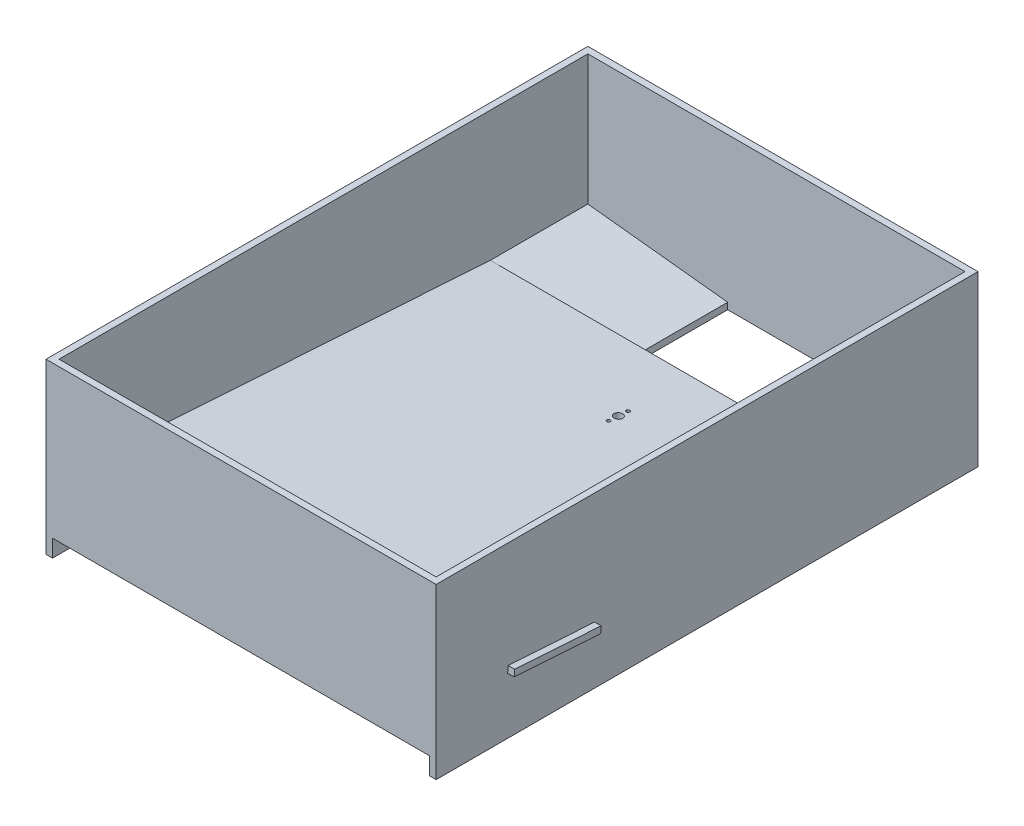
from build123d import *

# Parameters (mm, degrees)
SKETCH_1_W           = 180
SKETCH_1_H           = 250
EXTRUDE_1_DEPTH      = 70
SHELL_1_T            = -3
EXTRUDE_2_REACH      = 229.715
EXTRUDE_3_DEPTH      = 45
SKETCH_5_W           = 174
SKETCH_5_H           = 6.993605462
EXTRUDE_6_DEPTH      = 3
EXTRUDE_7_DEPTH      = 180
EXTRUDE_7_DEPTH_BACK = 6
SKETCH_12_W          = 3
SKETCH_12_H          = 250
EXTRUDE_8_DEPTH      = 8
SKETCH_13_R          = 2
SKETCH_13_R_2        = 0.8
CUT_EXTRUDE_1_DEPTH  = 3


with BuildPart() as part:
    # 草图1 → 凸台-拉伸1 (new body)
    with BuildSketch(Plane(origin=(0, 0, 0), x_dir=(1, 0, 0), z_dir=(0, 1, 0))):
        Rectangle(SKETCH_1_W, SKETCH_1_H)
    extrude(amount=EXTRUDE_1_DEPTH)

    # 抽壳1
    shell_1_openings = [part.faces().sort_by_distance(p)[0] for p in [
        (0, 70, 0),
        (0, 0, 0),
    ]]
    offset(amount=SHELL_1_T, openings=shell_1_openings, kind=Kind.INTERSECTION)

    # 草图3 → 凸台-拉伸2 (add, up to next)
    with BuildSketch(Plane(origin=(-87, 0, 0), x_dir=(0, 0, -1), z_dir=(1, 0, 0)), mode=Mode.PRIVATE) as extrude_2_sk1:
        Polygon((-122, 23), (77, 10), (77, 6.993605462), (-122, 19.993605462), align=None)
    extrude_2_tool1 = extrude(extrude_2_sk1.sketch, amount=EXTRUDE_2_REACH, mode=Mode.PRIVATE) - part.part
    add(extrude_2_tool1.solids().sort_by_distance((-87, 14.996803, 22.5))[0])

    # 草图4 → 凸台-拉伸3 (add)
    with BuildSketch(Plane.XY.offset(-122)):
        Polygon((-87, 10), (-87, 7), (-22.5, 0), (-22.5, 3), align=None)
        Polygon((22.5, 3), (87, 10), (87, 7), (22.5, 0), align=None)
    extrude(amount=EXTRUDE_3_DEPTH)

    # 草图6 → 凸台-拉伸7 (add, two sides: drawn at the far end of the back side and taken through both)
    with BuildSketch(Plane(origin=(-87, 0, 0), x_dir=(0, 0, -1), z_dir=(1, 0, 0)).offset(-EXTRUDE_7_DEPTH_BACK)):
        Polygon((-92, 18.033806467), (-52.085079166, 15.426299075), (-51.889516111, 18.419918138), (-91.804436946, 21.027425529), align=None)
    extrude(amount=EXTRUDE_7_DEPTH + EXTRUDE_7_DEPTH_BACK)

    # 草图12 → 凸台-拉伸8 (add)
    with BuildSketch(Plane.XZ):
        with Locations((-88.5, 0)):
            Rectangle(SKETCH_12_W, SKETCH_12_H)
        with Locations((88.5, 0)):
            Rectangle(SKETCH_12_W, SKETCH_12_H)
    extrude(amount=EXTRUDE_8_DEPTH)

    # 草图13 → 切除-拉伸1 (cut)
    with BuildSketch(Plane(origin=(0, 14.966281116, -0.977696756), x_dir=(1, 0, 0), z_dir=(0, 0.9978730208564016, -0.06518768477956395))):
        with Locations(Location((7, 41.184345758, 0), (0, 0, 270))):
            Circle(SKETCH_13_R)
        with Locations(Location((7, 45.684345758, 0), (0, 0, 270))):
            Circle(SKETCH_13_R_2)
        with Locations(Location((7, 36.684345758, 0), (0, 0, 270))):
            Circle(SKETCH_13_R_2)
    extrude(amount=-CUT_EXTRUDE_1_DEPTH, mode=Mode.SUBTRACT)


with BuildPart() as body_2:
    # 草图5 → 凸台-拉伸6 (new body)
    with BuildSketch(Plane.XY.offset(-77)):
        with Locations((0, 3.496802731)):
            Rectangle(SKETCH_5_W, SKETCH_5_H)
    extrude(amount=EXTRUDE_6_DEPTH)


solid = Compound([part.part, body_2.part])
